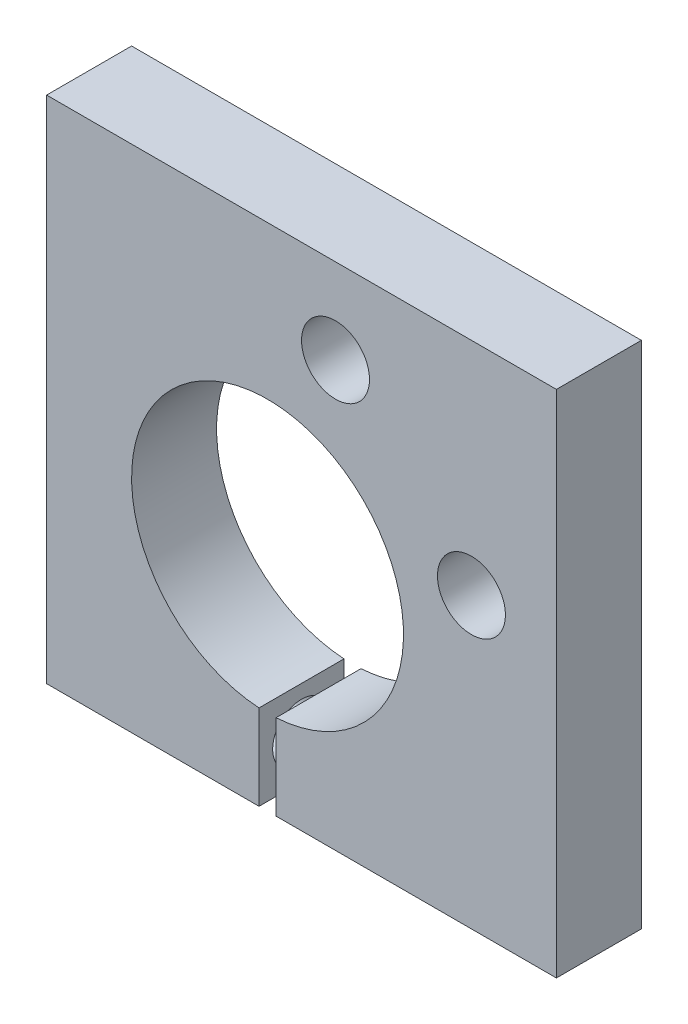
from build123d import *

# Parameters (mm, degrees)
SCHIZZO1_R                   = 2
ESTRUSIONE_ESTRUSIONE1_DEPTH = 5
FORO_PER_VITE_M3_1_D         = 3.4
FORO_PER_VITE_M3_1_DEPTH     = 12.5
FORO_FILETTATO_M3_1_D        = 2.5
FORO_FILETTATO_M3_1_DEPTH    = 4.5
FORO_FILETTATO_M3_1_TIP      = 0.751075774


with BuildPart() as part:
    # Schizzo1 → Estrusione-Estrusione1 (new body)
    with BuildSketch(Plane.XY):
        with BuildLine():
            Line((0, 30), (0, 0))
            Line((0, 0), (12.5, 0))
            Line((12.5, 0), (12.5, 5.015640289))
            ThreePointArc((12.5, 5.015640289), (13, 21), (13.5, 5.015640289))
            Line((13.5, 5.015640289), (13.5, 0))
            Line((13.5, 0), (30, 0))
            Line((30, 0), (30, 30))
            Line((30, 30), (0, 30))
        make_face()
        with Locations((25, 17)):
            Circle(SCHIZZO1_R, mode=Mode.SUBTRACT)
        with Locations((17, 25)):
            Circle(SCHIZZO1_R, mode=Mode.SUBTRACT)
    extrude(amount=ESTRUSIONE_ESTRUSIONE1_DEPTH)

    # Foro per Vite M3-1
    with Locations(Plane.ZY):
        with Locations((2.5, 2.507820144)):
            Hole(FORO_PER_VITE_M3_1_D / 2, depth=FORO_PER_VITE_M3_1_DEPTH)

    # Foro filettato M3-1
    with Locations(Plane.ZY.offset(-13.5)):
        with Locations((2.5, 2.507820144)):
            Hole(FORO_FILETTATO_M3_1_D / 2, depth=FORO_FILETTATO_M3_1_DEPTH)
            with Locations((0, 0, -(FORO_FILETTATO_M3_1_DEPTH + FORO_FILETTATO_M3_1_TIP / 2))):  # 118° drill point
                Cone(0, FORO_FILETTATO_M3_1_D / 2, FORO_FILETTATO_M3_1_TIP, mode=Mode.SUBTRACT)


solid = part.part
